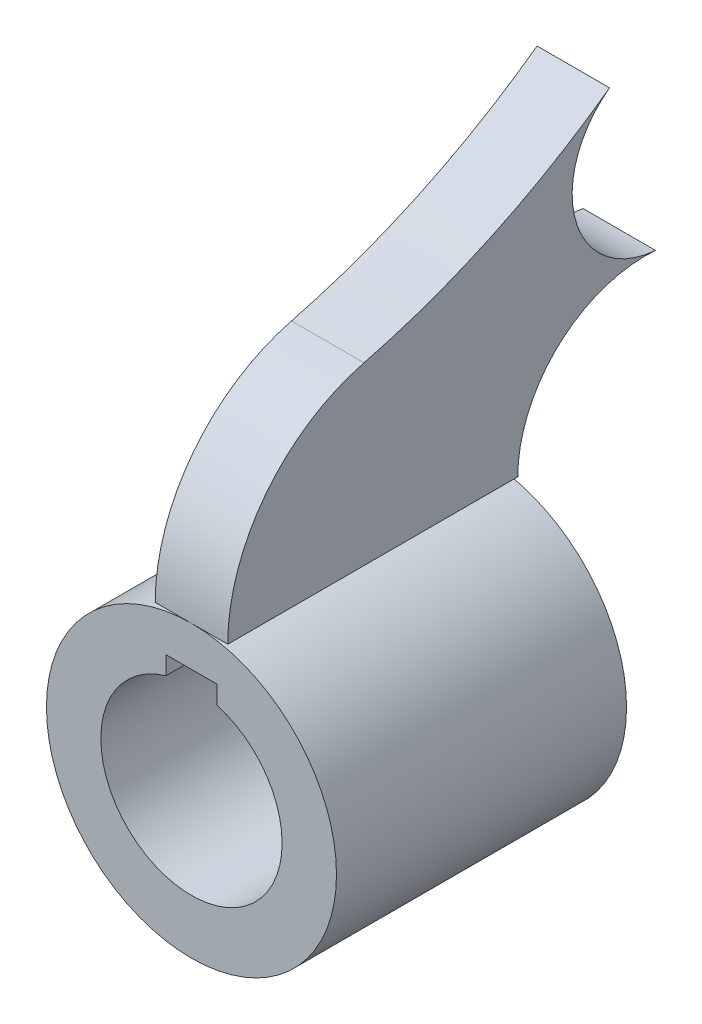
from build123d import *

# Parameters (mm, degrees)
SKETCH1_R           = 40
BOSS_EXTRUDE1_DEPTH = 80
BOSS_EXTRUDE2_DEPTH = 10


with BuildPart() as part:
    # Sketch1 → Boss-Extrude1 (new body)
    with BuildSketch(Plane.XY):
        Circle(SKETCH1_R)
        with BuildLine():
            Line((-7, 29), (7, 29))
            Line((7, 29), (7, 24))
            ThreePointArc((7, 24), (0, -25), (-7, 24))
            Line((-7, 24), (-7, 29))
        make_face(mode=Mode.SUBTRACT)
    extrude(amount=-BOSS_EXTRUDE1_DEPTH)


with BuildPart() as body_2:
    # Sketch2 → Boss-Extrude2 (new, symmetric)
    with BuildSketch(Plane(origin=(0, 0, 0), x_dir=(0, 0, -1), z_dir=(1, 0, 0))):
        with BuildLine():
            ThreePointArc((37.590861727, 88.435661318), (10.500272699, 70.655693487), (0, 40))
            Line((0, 40), (80, 40))
            ThreePointArc((80, 40), (91.322065693, 65.859428989), (118.003195099, 75.079872188))
            ThreePointArc((118.003195099, 75.079872188), (95.929990804, 93.244657129), (105.328256515, 120.242034066))
            ThreePointArc((105.328256515, 120.242034066), (72.960415449, 101.142504042), (37.590861727, 88.435661318))
        make_face()
    extrude(amount=BOSS_EXTRUDE2_DEPTH, both=True)


solid = Compound([part.part, body_2.part])
